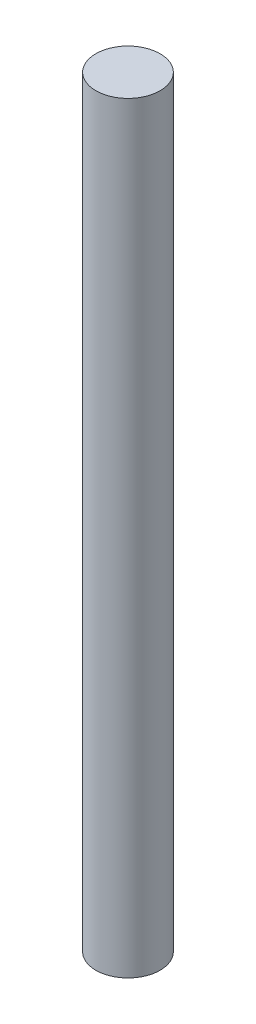
from build123d import *

# Parameters (mm, degrees)
SKETCH1_R           = 1.5
BOSS_EXTRUDE1_DEPTH = 35.6


with BuildPart() as part:
    # Sketch1 → Boss-Extrude1 (new body)
    with BuildSketch(Plane(origin=(0, 0, 0), x_dir=(1, 0, 0), z_dir=(0, 1, 0))):
        with Locations(Location((0, 0, 0), (0, 0, 270))):
            Circle(SKETCH1_R)
    extrude(amount=BOSS_EXTRUDE1_DEPTH)


solid = part.part
